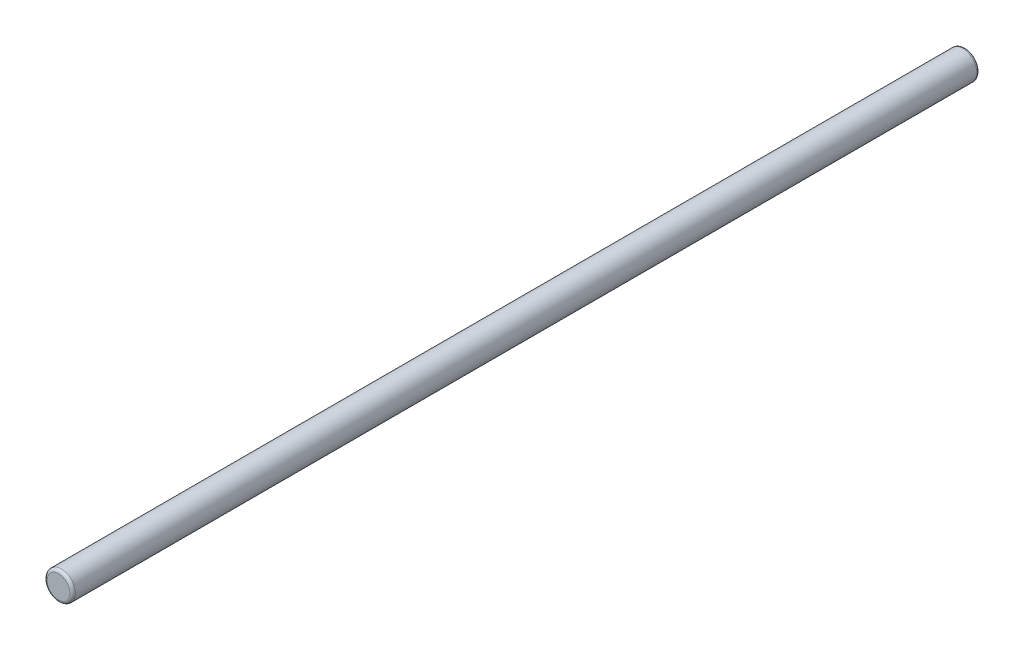
from build123d import *

# Parameters (mm, degrees)
ESQUISSE1_R        = 1.25
BOSS_EXTRU_1_DEPTH = 80
CONG_1_R           = 0.25


with BuildPart() as part:
    # Esquisse1 → Boss.-Extru.1 (new body)
    with BuildSketch(Plane.XY):
        Circle(ESQUISSE1_R)
    extrude(amount=BOSS_EXTRU_1_DEPTH)

    # Congé1
    cong_1_edges = [part.edges().sort_by_distance(p)[0] for p in [
        (-1.25, 0, 0),
        (-1.25, 0, 80),
    ]]
    fillet(cong_1_edges, radius=CONG_1_R)


solid = part.part
